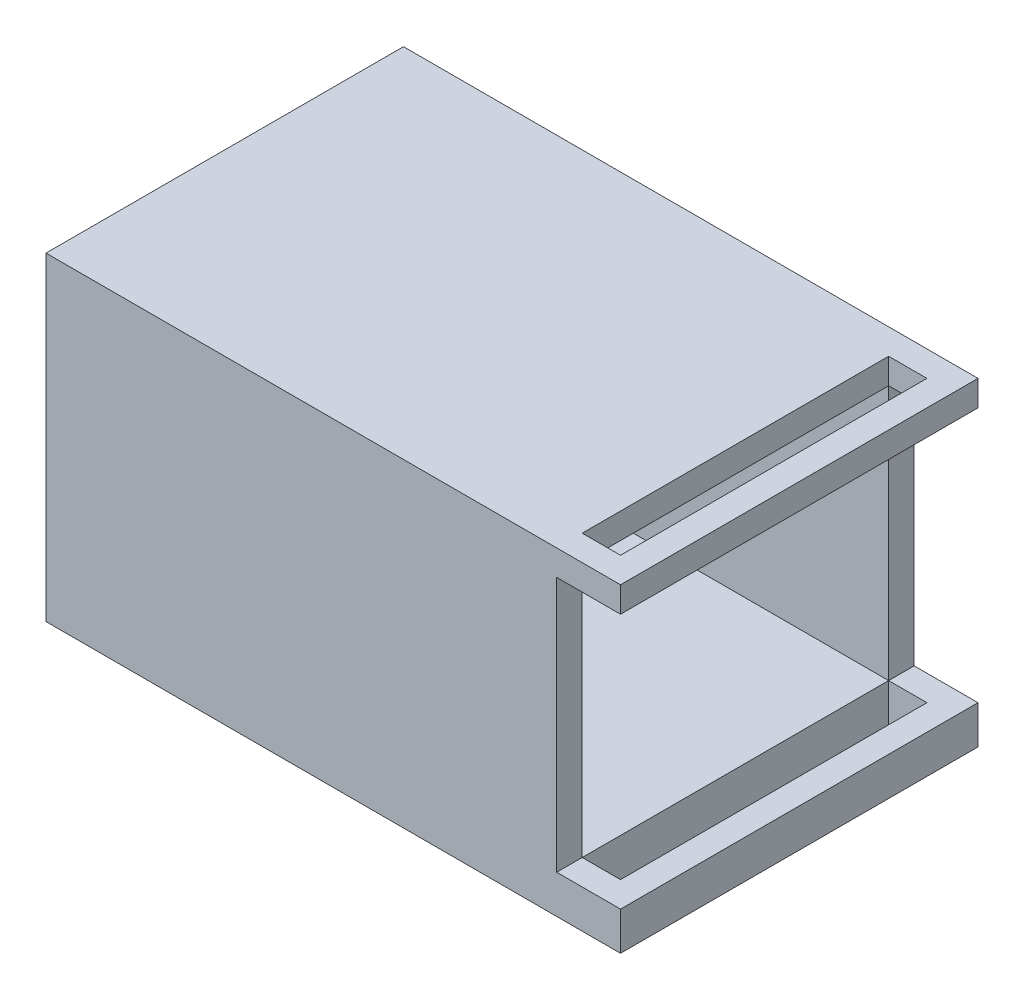
from build123d import *

# Parameters (mm, degrees)
SKETCH1_W           = 45
SKETCH1_H           = 28
BOSS_EXTRUDE1_DEPTH = 3
BOSS_EXTRUDE2_DEPTH = 22
SKETCH4_W           = 45
SKETCH4_H           = 28
SKETCH4_W_2         = 3
SKETCH4_H_2         = 24
BOSS_EXTRUDE4_DEPTH = 2
SKETCH5_W           = 9
SKETCH5_H           = 3.5
CUT_EXTRUDE1_DEPTH  = 2
SKETCH6_W           = 3
SKETCH6_H           = 24
CUT_EXTRUDE2_DEPTH  = 3


with BuildPart() as part:
    # Sketch1 → Boss-Extrude1 (new body)
    with BuildSketch(Plane(origin=(0, 0, 0), x_dir=(1, 0, 0), z_dir=(0, 1, 0))):
        with Locations((22.5, 14)):
            Rectangle(SKETCH1_W, SKETCH1_H)
    extrude(amount=BOSS_EXTRUDE1_DEPTH)

    # Sketch2 → Boss-Extrude2 (add)
    with BuildSketch(Plane(origin=(0, 3, 0), x_dir=(1, 0, 0), z_dir=(0, 1, 0))):
        Polygon((40, 26), (40, 28), (0, 28), (0, 0), (40, 0), (40, 2), (2, 2), (2, 26), align=None)
    extrude(amount=BOSS_EXTRUDE2_DEPTH)

    # Sketch4 → Boss-Extrude4 (add)
    with BuildSketch(Plane(origin=(0, 25, 0), x_dir=(1, 0, 0), z_dir=(0, 1, 0))):
        with Locations((22.5, 14)):
            Rectangle(SKETCH4_W, SKETCH4_H)
        with Locations((41.5, 14)):
            Rectangle(SKETCH4_W_2, SKETCH4_H_2, mode=Mode.SUBTRACT)
    extrude(amount=-BOSS_EXTRUDE4_DEPTH)

    # Sketch5 → Cut-Extrude1 (cut)
    with BuildSketch(Plane.ZY):
        with BuildLine():
            Line((-18.72, 5.25), (-18.72, 5.96))
            ThreePointArc((-18.72, 5.96), (-18.353883476, 6.843883476), (-17.47, 7.21))
            Line((-17.47, 7.21), (-10.53, 7.21))
            ThreePointArc((-10.53, 7.21), (-9.646116524, 6.843883476), (-9.28, 5.96))
            Line((-9.28, 5.96), (-9.28, 5.25))
            ThreePointArc((-9.28, 5.25), (-9.646116524, 4.366116524), (-10.53, 4))
            Line((-10.53, 4), (-17.47, 4))
            ThreePointArc((-17.47, 4), (-18.353883476, 4.366116524), (-18.72, 5.25))
        make_face()
        with Locations((-14, 10.25)):
            Rectangle(SKETCH5_W, SKETCH5_H)
    extrude(amount=-CUT_EXTRUDE1_DEPTH, mode=Mode.SUBTRACT)

    # Sketch6 → Cut-Extrude2 (cut)
    with BuildSketch(Plane(origin=(0, 3, 0), x_dir=(1, 0, 0), z_dir=(0, 1, 0))):
        with Locations((41.5, 14)):
            Rectangle(SKETCH6_W, SKETCH6_H)
    extrude(amount=-CUT_EXTRUDE2_DEPTH, mode=Mode.SUBTRACT)


solid = part.part
